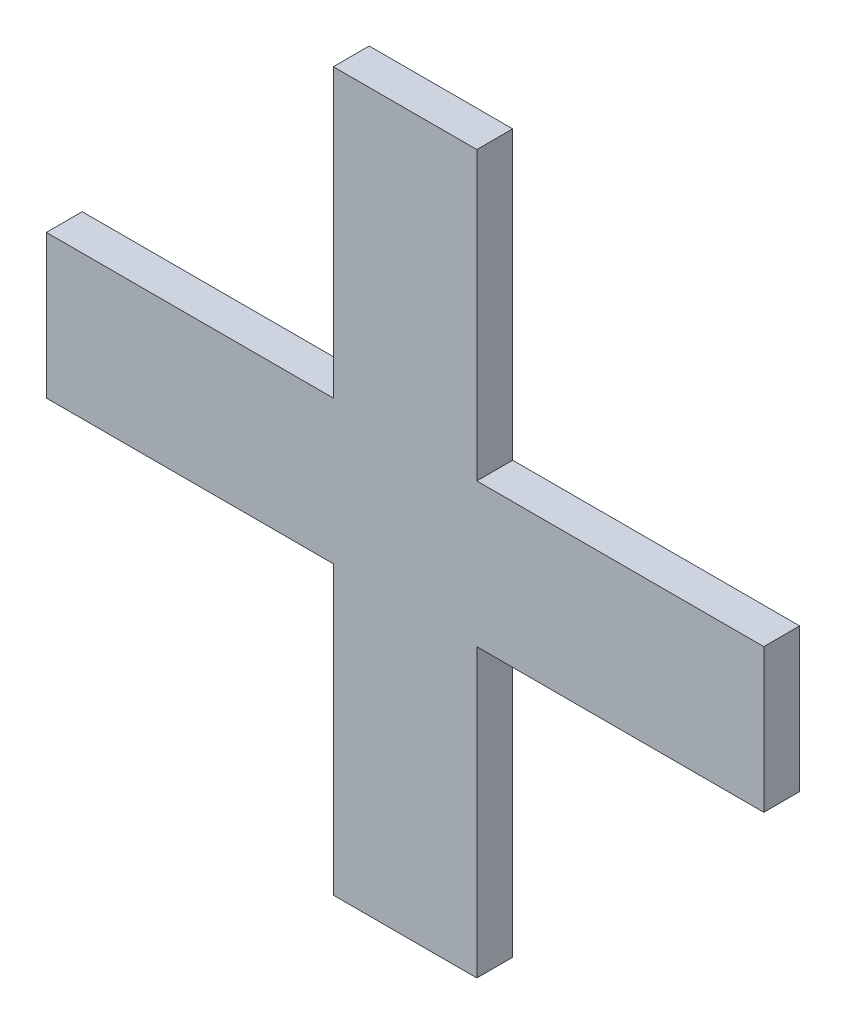
from build123d import *

# Parameters (mm, degrees)
BOSS_EXTRUDE1_DEPTH = 3.175


with BuildPart() as part:
    # Sketch1 → Boss-Extrude1 (new body)
    with BuildSketch(Plane.XY):
        Polygon((-6.35, 33.578030303), (6.35, 33.578030303), (6.35, 8.178030303), (31.75, 8.178030303), (31.75, -4.521969697), (6.35, -4.521969697), (6.35, -29.921969697), (-6.35, -29.921969697), (-6.35, -4.521969697), (-31.75, -4.521969697), (-31.75, 8.178030303), (-6.35, 8.178030303), align=None)
    extrude(amount=BOSS_EXTRUDE1_DEPTH)


solid = part.part
